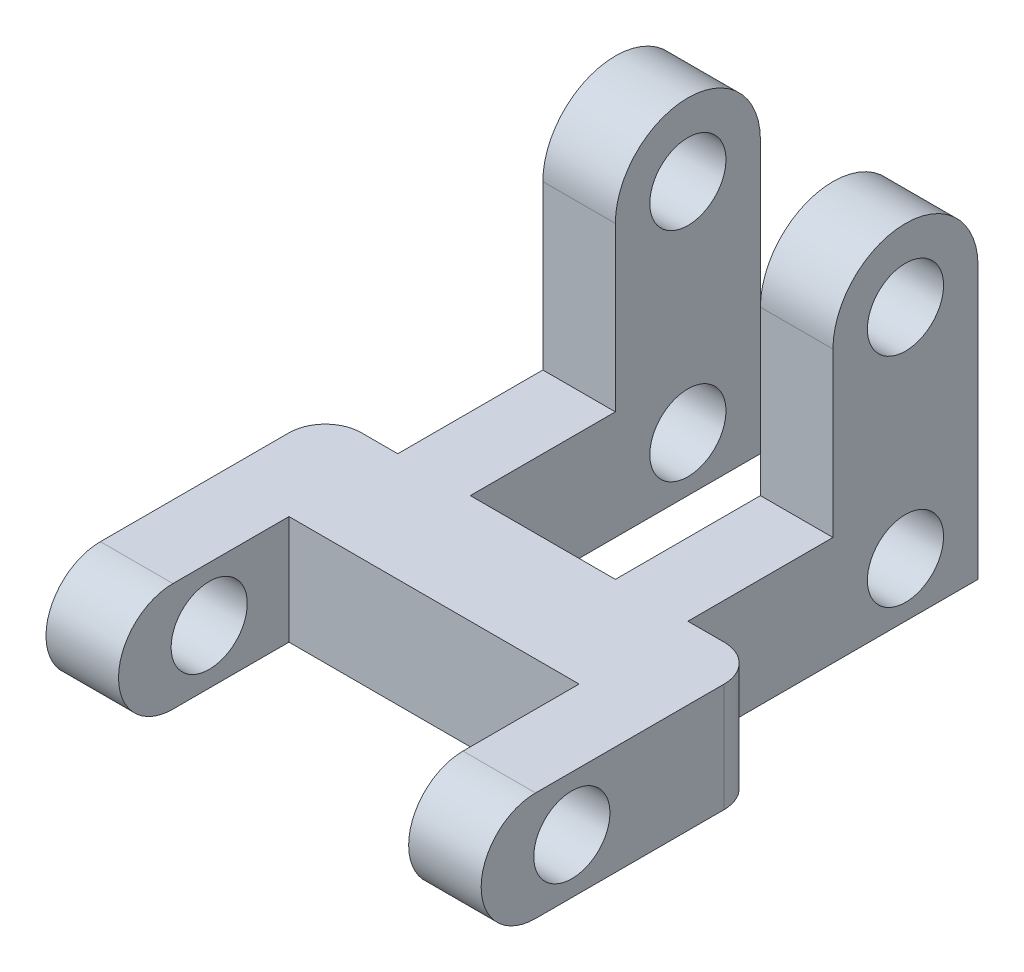
from build123d import *

# Parameters (mm, degrees)
EXTRUDE_1_DEPTH          = 3
SKETCH_2_OUTSIDE_W       = 13.724
SKETCH_2_OUTSIDE_H       = 8.024
CUT_EXTRUDE_1_DEPTH      = 12
SKETCH_3_R               = 1.05
CUT_EXTRUDE_2_DEPTH      = 12
FILLET_1_R               = 1
SKETCH_4_R               = 0.95
EXTRUDE_2_DEPTH          = 2
SKETCH_5_W               = 8
SKETCH_5_H               = 3
EXTRUDE_3_DEPTH          = 6
SKETCH_6_R               = 1.05
CUT_EXTRUDE_3_DEPTH      = 12
CUT_EXTRUDE_4_DEPTH      = 8
EXTRUDE_5_DEPTH          = 2
SKETCH_13_W              = 8
SKETCH_13_H              = 3
EXTRUDE_8_DEPTH          = 2
SKETCH_14_W              = 4
SKETCH_14_H              = 6
CUT_EXTRUDE_5_DEPTH      = 10
CUT_EXTRUDE_6_DEPTH      = 15.773286703
CUT_EXTRUDE_6_DEPTH_BACK = 15.773286703
SKETCH_11_R              = 1.05


with BuildPart() as part:
    # 草图1 → 凸台-拉伸1 (new body)
    with BuildSketch(Plane(origin=(0, 0, 0), x_dir=(1, 0, 0), z_dir=(0, 1, 0))):
        Polygon((-6, 0), (6, 0), (6, -8.7), (4, -8.7), (4, -3), (-4, -3), (-4, -8.7), (-6, -8.7), align=None)
    extrude(amount=EXTRUDE_1_DEPTH)

    # 草图2 outside → 切除-拉伸1 (cut)
    with BuildSketch(Plane.ZY.offset(6)):
        with Locations((4.35, 1.5)):
            Rectangle(SKETCH_2_OUTSIDE_W, SKETCH_2_OUTSIDE_H)
        with BuildLine():
            Line((6.2, 3), (0, 3))
            Line((0, 3), (0, 0))
            Line((0, 0), (6.2, 0))
            ThreePointArc((6.2, 0), (7.7, 1.5), (6.2, 3))
        make_face(mode=Mode.SUBTRACT)
    extrude(amount=-CUT_EXTRUDE_1_DEPTH, mode=Mode.SUBTRACT)

    # 草图3 → 切除-拉伸2 (cut)
    with BuildSketch(Plane.ZY.offset(6)):
        with Locations((5.2, 1.5)):
            Circle(SKETCH_3_R)
    extrude(amount=-CUT_EXTRUDE_2_DEPTH, mode=Mode.SUBTRACT)

    # 圆角1
    fillet_1_edges = [part.edges().sort_by_distance(p)[0] for p in [
        (-6, 1.5, 0),
        (6, 1.5, 0),
    ]]
    fillet(fillet_1_edges, radius=FILLET_1_R)

    # 草图4 → 凸台-拉伸2 (add)
    with BuildSketch(Plane(origin=(0, 0, 0), x_dir=(-1, 0, 0), z_dir=(0, 0, -1))):
        with Locations(Location((0, 1.5, 0), (0, 0, 180))):
            Circle(SKETCH_4_R)
    extrude(amount=EXTRUDE_2_DEPTH)

    # 草图5 → 凸台-拉伸3 (add)
    with BuildSketch(Plane(origin=(0, 0, -2), x_dir=(-1, 0, 0), z_dir=(0, 0, -1))):
        with Locations((0, 1.5)):
            Rectangle(SKETCH_5_W, SKETCH_5_H)
    extrude(amount=EXTRUDE_3_DEPTH)

    # 草图6 → 切除-拉伸3 (cut)
    with BuildSketch(Plane(origin=(4, 0, 0), x_dir=(0, 0, -1), z_dir=(1, 0, 0))):
        with Locations(Location((6, 1.5, 0), (0, 0, 90))):
            Circle(SKETCH_6_R)
    extrude(amount=-CUT_EXTRUDE_3_DEPTH, mode=Mode.SUBTRACT)

    # 草图8 → 切除-拉伸4 (cut)
    with BuildSketch(Plane(origin=(0, 3, 0), x_dir=(1, 0, 0), z_dir=(0, 1, 0))):
        Polygon((-1.5, 8), (1.5, 8), (2, 8), (2, 6), (1.5, 6), (-1.5, 6), (-2, 6), (-2, 8), align=None)
    extrude(amount=-CUT_EXTRUDE_4_DEPTH, mode=Mode.SUBTRACT)

    # 草图10 → 凸台-拉伸5 (add)
    with BuildSketch(Plane.ZY.offset(4)):
        with BuildLine():
            Line((-8, 3), (-8, 7.5))
            ThreePointArc((-8, 7.5), (-6, 9.5), (-4, 7.5))
            Line((-4, 7.5), (-4, 3))
            Line((-4, 3), (-8, 3))
        make_face()
    extrude_5 = extrude(amount=-EXTRUDE_5_DEPTH)

    # 镜向2: 凸台-拉伸5 across plane
    add(extrude_5.mirror(Plane(origin=(0, 0, 0), x_dir=(0, 0, 1), z_dir=(1, 0, 0))))

    # 草图13 → 凸台-拉伸8 (add)
    with BuildSketch(Plane.XY.offset(-2)):
        with Locations((0, 1.5)):
            Rectangle(SKETCH_13_W, SKETCH_13_H)
    extrude(amount=EXTRUDE_8_DEPTH)

    # 草图14 → 切除-拉伸5 (cut)
    with BuildSketch(Plane(origin=(0, 3, 0), x_dir=(1, 0, 0), z_dir=(0, 1, 0))):
        with Locations((0, 3)):
            Rectangle(SKETCH_14_W, SKETCH_14_H)
    extrude(amount=-CUT_EXTRUDE_5_DEPTH, mode=Mode.SUBTRACT)

    # 草图11 → 切除-拉伸6 (cut, two sides: drawn at the far end of the back side and taken through both)
    with BuildSketch(Plane.ZY.offset(2).offset(-CUT_EXTRUDE_6_DEPTH_BACK)):
        with Locations(Location((-6, 7.5, 0), (0, 0, 270))):
            Circle(SKETCH_11_R)
    extrude(amount=CUT_EXTRUDE_6_DEPTH + CUT_EXTRUDE_6_DEPTH_BACK, mode=Mode.SUBTRACT)


solid = part.part
